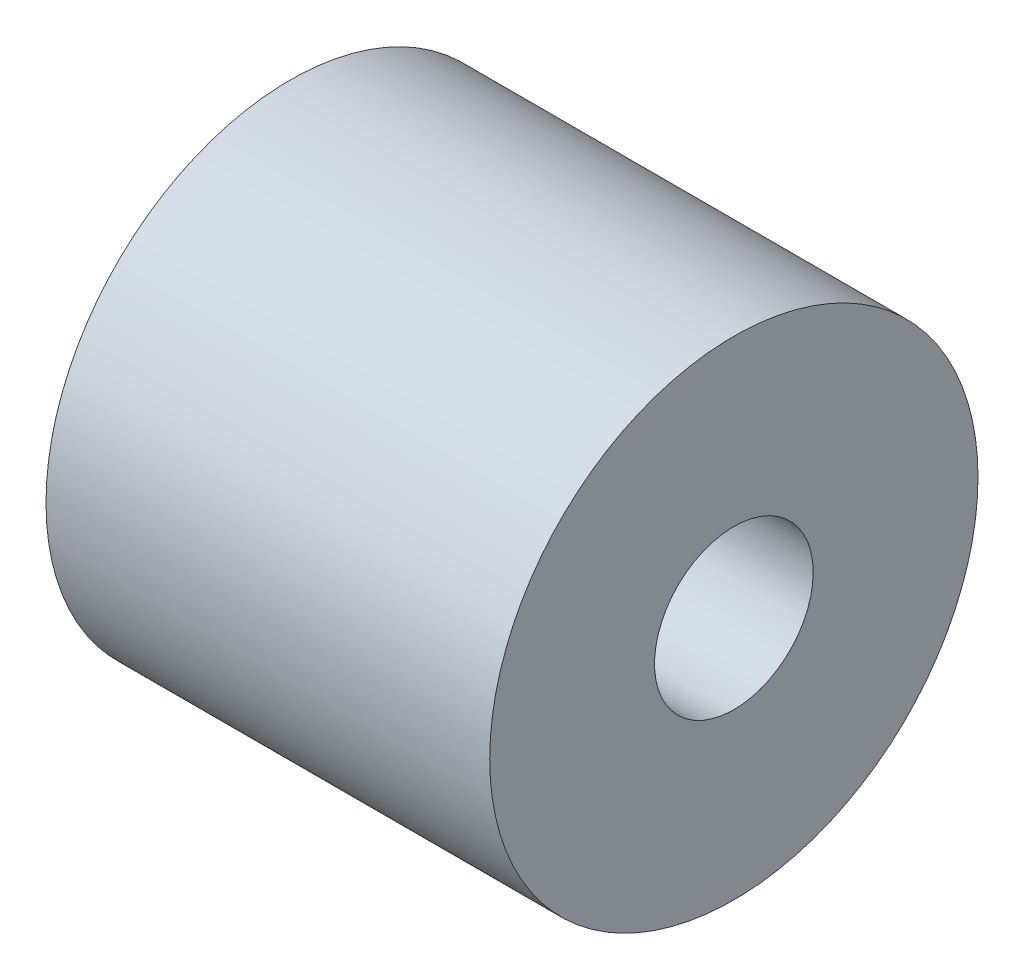
from build123d import *

# Parameters (mm, degrees)
SKETCH1_R           = 10
SKETCH1_R_2         = 3.25
BOSS_EXTRUDE1_DEPTH = 18.175


with BuildPart() as part:
    # Sketch1 → Boss-Extrude1 (new body)
    with BuildSketch(Plane(origin=(0, 0, 0), x_dir=(0, 0, -1), z_dir=(1, 0, 0))):
        Circle(SKETCH1_R)
        Circle(SKETCH1_R_2, mode=Mode.SUBTRACT)
    extrude(amount=BOSS_EXTRUDE1_DEPTH)


solid = part.part
